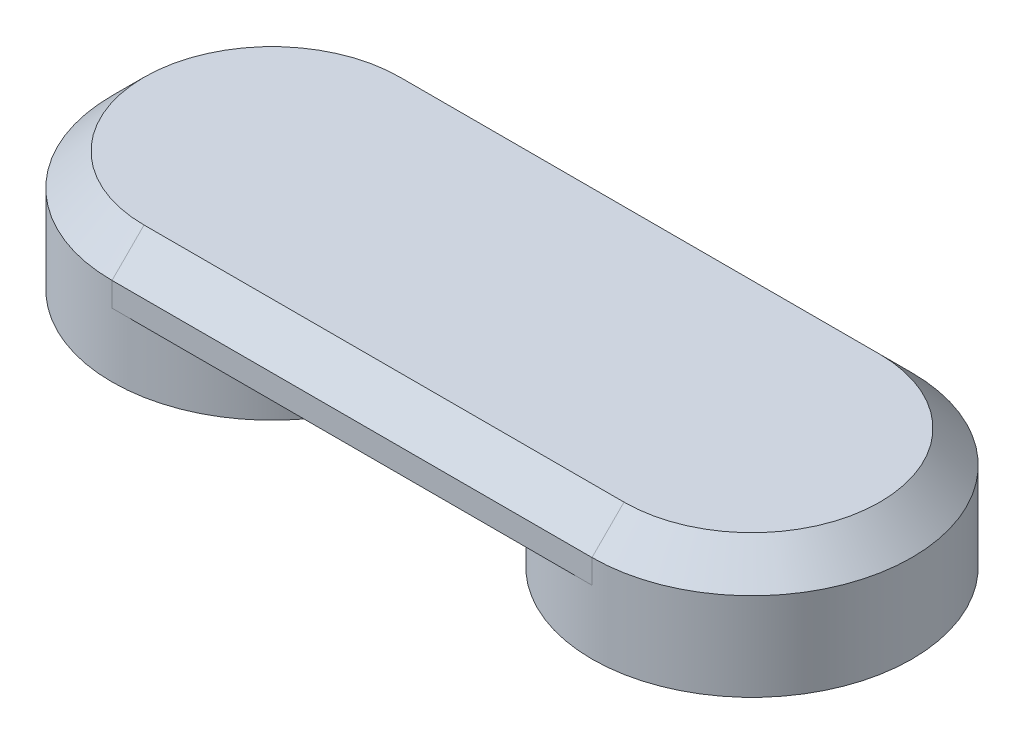
from build123d import *

# Parameters (mm, degrees)
EXTRUDE_1_DEPTH     = 15
CHAMFER_1_SIZE      = 4
SKETCH_3_OUTSIDE_W  = 123.748
SKETCH_3_OUTSIDE_H  = 63.748
SKETCH_3_OUTSIDE_R  = 20
CUT_EXTRUDE_1_DEPTH = 8
SKETCH_4_R          = 5
EXTRUDE_2_DEPTH     = 14


with BuildPart() as part:
    # 草图1 → 凸台-拉伸1 (new body)
    with BuildSketch(Plane(origin=(0, 0, 0), x_dir=(1, 0, 0), z_dir=(0, 1, 0))):
        with BuildLine():
            Line((30, -20), (-30, -20))
            ThreePointArc((-30, -20), (-50, 0), (-30, 20))
            Line((-30, 20), (30, 20))
            ThreePointArc((30, 20), (50, 0), (30, -20))
        make_face()
    extrude(amount=EXTRUDE_1_DEPTH)

    # 倒角1
    chamfer_1_edges = [part.edges().sort_by_distance(p)[0] for p in [
        (-50, 15, 0),
        (0, 15, 20),
        (50, 15, 0),
        (0, 15, -20),
    ]]
    chamfer(chamfer_1_edges, length=CHAMFER_1_SIZE)

    # 草图3 outside → 切除-拉伸1 (cut)
    with BuildSketch(Plane.XZ):
        Rectangle(SKETCH_3_OUTSIDE_W, SKETCH_3_OUTSIDE_H)
        with Locations(Location((-30, 0, 0), (0, 0, 90))):
            Circle(SKETCH_3_OUTSIDE_R, mode=Mode.SUBTRACT)
        with Locations(Location((30, 0, 0), (0, 0, 90))):
            Circle(SKETCH_3_OUTSIDE_R, mode=Mode.SUBTRACT)
    extrude(amount=-CUT_EXTRUDE_1_DEPTH, mode=Mode.SUBTRACT)

    # 草图4 → 凸台-拉伸2 (add)
    with BuildSketch(Plane.XZ.offset(-8)):
        with Locations(Location((0, 0, 0), (0, 0, 270))):
            Circle(SKETCH_4_R)
    extrude(amount=EXTRUDE_2_DEPTH)


solid = part.part
